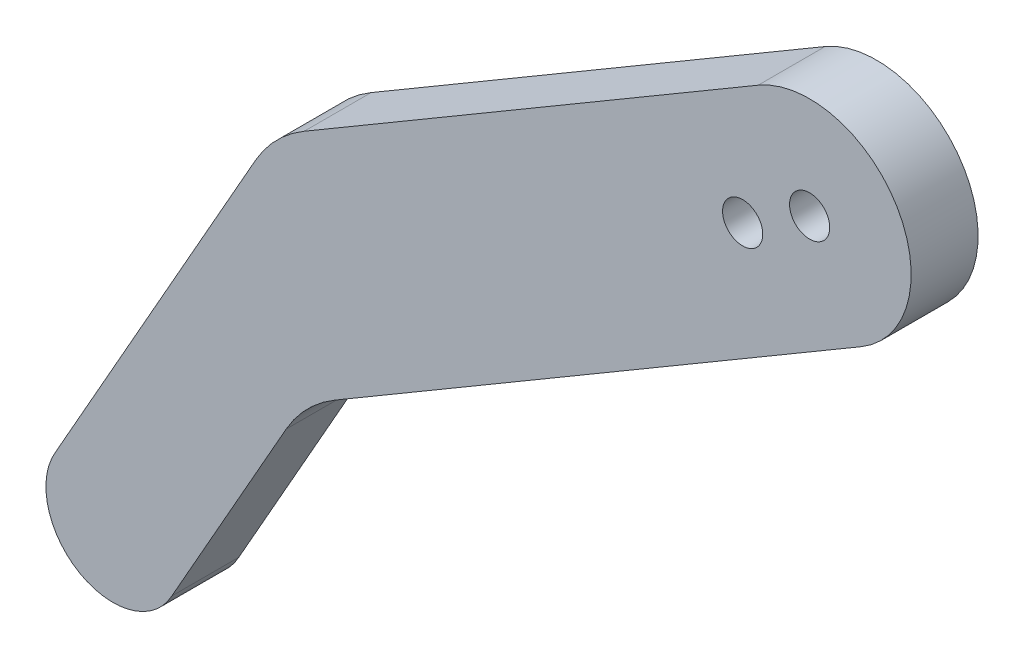
from build123d import *

# Parameters (mm, degrees)
BOSS_EXTRUDE1_DEPTH = 5
SKETCH4_R           = 1.5
CUT_EXTRUDE1_DEPTH  = 7


with BuildPart() as part:
    # Sketch3 → Boss-Extrude1 (new body)
    with BuildSketch(Plane.XY):
        with BuildLine():
            Line((0, 0), (14.953964561, 26.376355963))
            ThreePointArc((14.953964561, 26.376355963), (16.526868073, 28.459816854), (18.585415556, 30.065188152))
            Line((18.585415556, 30.065188152), (52.482823047, 49.991756364))
            ThreePointArc((52.482823047, 49.991756364), (62.858898852, 47.298486579), (60.165629068, 36.922410774))
            Line((60.165629068, 36.922410774), (20.8730428, 13.824290344))
            ThreePointArc((20.8730428, 13.824290344), (18.814495317, 12.218919046), (17.241591805, 10.135458155))
            Line((17.241591805, 10.135458155), (8.699180072, -4.931963714))
            ThreePointArc((8.699180072, -4.931963714), (1.838948591, -6.894344126), (0, 0))
        make_face()
    extrude(amount=BOSS_EXTRUDE1_DEPTH)

    # Sketch4 → Cut-Extrude1 (cut)
    with BuildSketch(Plane.XY.offset(5)):
        with Locations((56.324226058, 43.457083569)):
            Circle(SKETCH4_R)
        with Locations((51.324226058, 40.517836929)):
            Circle(SKETCH4_R)
    extrude(amount=-CUT_EXTRUDE1_DEPTH, mode=Mode.SUBTRACT)


solid = part.part
